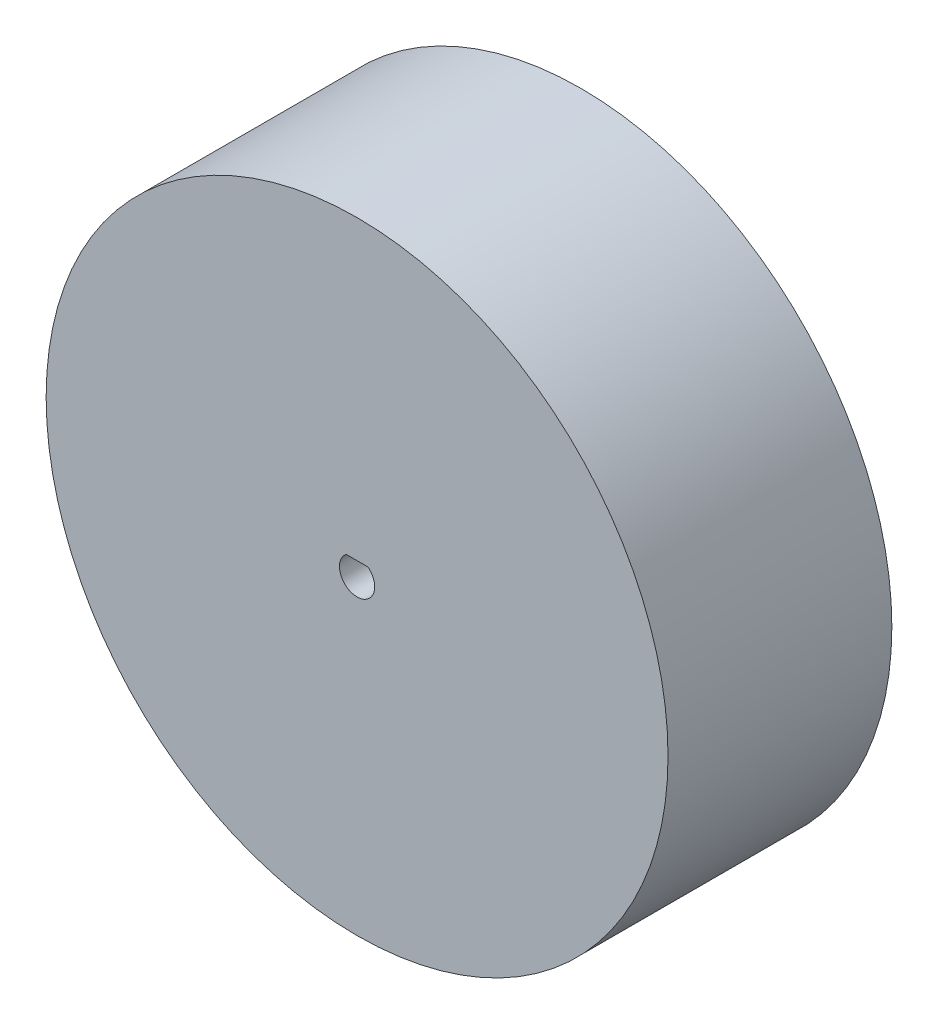
from build123d import *

# Parameters (mm, degrees)
SKETCH1_R           = 28.5
BOSS_EXTRUDE1_DEPTH = 26
BOSS_EXTRUDE2_START = -26
SKETCH2_R           = 36.12
SKETCH2_R_2         = 28.5
BOSS_EXTRUDE2_DEPTH = 26


with BuildPart() as part:
    # Sketch1 → Boss-Extrude1 (new body)
    with BuildSketch(Plane.XY):
        with Locations(Location((0, 0, 0), (0, 0, 180))):
            Circle(SKETCH1_R)
        with BuildLine():
            Line((-1.27, 1.602466252), (1.27, 1.602466252))
            ThreePointArc((1.27, 1.602466252), (0, -2.0447), (-1.27, 1.602466252))
        make_face(mode=Mode.SUBTRACT)
    extrude(amount=BOSS_EXTRUDE1_DEPTH)

    # Sketch2 → Boss-Extrude2 (add)
    with BuildSketch(Plane.XY.offset(26).offset(BOSS_EXTRUDE2_START)):
        Circle(SKETCH2_R)
        Circle(SKETCH2_R_2, mode=Mode.SUBTRACT)
    extrude(amount=BOSS_EXTRUDE2_DEPTH)


solid = part.part
